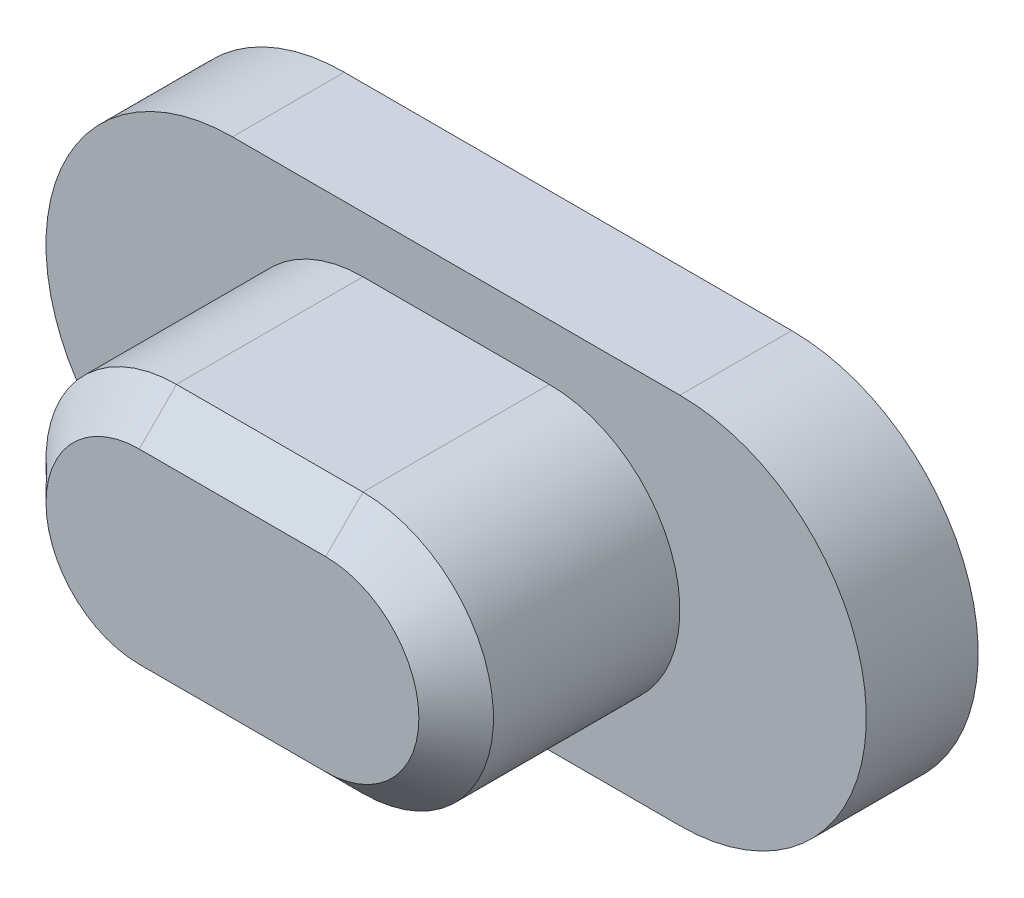
from build123d import *

# Parameters (mm, degrees)
EXTRUDE_1_DEPTH     = 3
EXTRUDE_2_DEPTH     = 6
CUT_EXTRUDE_1_DEPTH = 4
CHAMFER_1_SIZE      = 1


with BuildPart() as part:
    # Эскиз1 → Бобышка-Вытянуть1 (new body)
    with BuildSketch(Plane.XY):
        with BuildLine():
            Line((-6, 5), (6, 5))
            ThreePointArc((6, 5), (11, 0), (6, -5))
            Line((6, -5), (-6, -5))
            ThreePointArc((-6, -5), (-11, 0), (-6, 5))
        make_face()
    extrude(amount=EXTRUDE_1_DEPTH)

    # Эскиз2 → Бобышка-Вытянуть2 (add)
    with BuildSketch(Plane.XY.offset(3)):
        with BuildLine():
            Line((-2.5, 3.5), (2.5, 3.5))
            ThreePointArc((2.5, 3.5), (6, 0), (2.5, -3.5))
            Line((2.5, -3.5), (-2.5, -3.5))
            ThreePointArc((-2.5, -3.5), (-6, 0), (-2.5, 3.5))
        make_face()
    extrude(amount=EXTRUDE_2_DEPTH)

    # Эскиз3 → Вырез-Вытянуть1 (cut)
    with BuildSketch(Plane(origin=(0, 0, 0), x_dir=(-1, 0, 0), z_dir=(0, 0, -1))):
        with BuildLine():
            Line((0.75, -2), (-0.75, -2))
            ThreePointArc((-0.75, -2), (-2.75, 0), (-0.75, 2))
            Line((-0.75, 2), (0.75, 2))
            ThreePointArc((0.75, 2), (2.75, 0), (0.75, -2))
        make_face()
    extrude(amount=-CUT_EXTRUDE_1_DEPTH, mode=Mode.SUBTRACT)

    # Фаска1
    chamfer_1_edges = [part.edges().sort_by_distance(p)[0] for p in [
        (-6, 0, 9),
        (0, -3.5, 9),
        (6, 0, 9),
        (0, 3.5, 9),
    ]]
    chamfer(chamfer_1_edges, length=CHAMFER_1_SIZE)


solid = part.part
